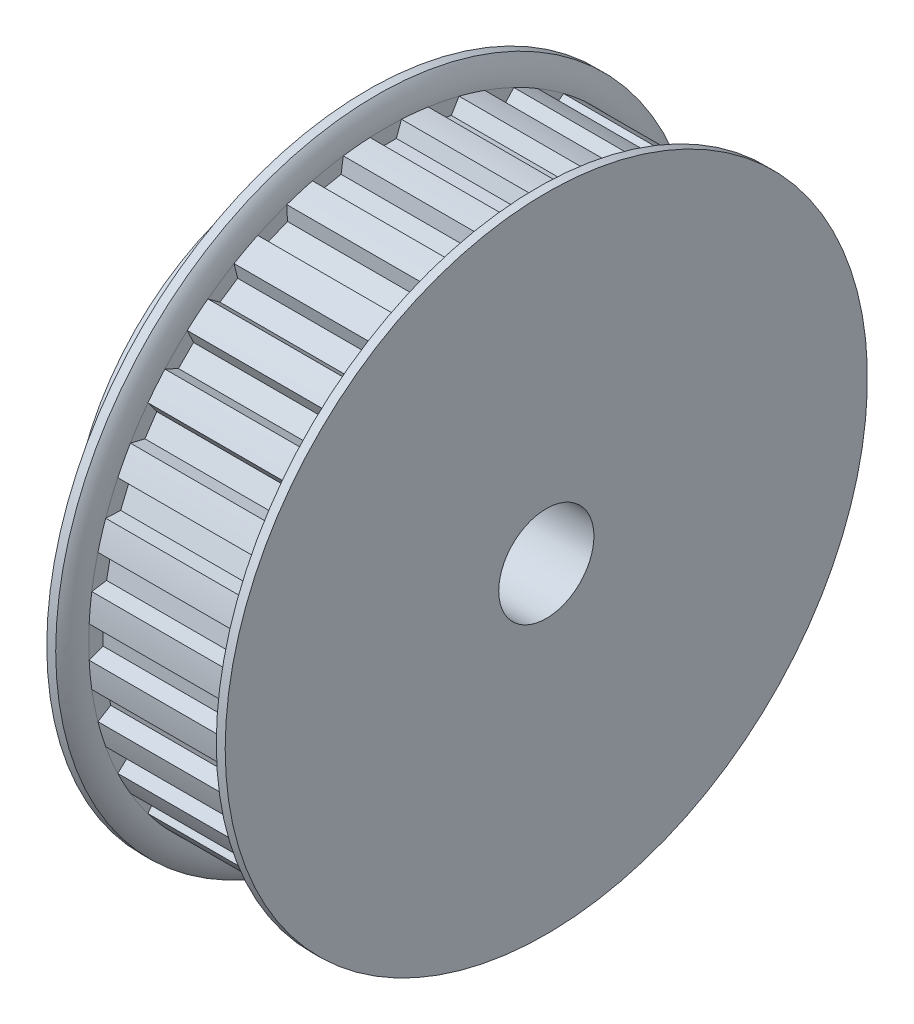
from build123d import *

# Parameters (mm, degrees)
CUT_EXTRUDE1_START = 9
CUT_EXTRUDE1_DEPTH = 12
CIRPATTERN1_COUNT  = 32


with BuildPart() as part:
    # Sketch6 → Revolve1 (revolve)
    with BuildSketch(Plane.XY, mode=Mode.PRIVATE) as revolve1_sk:
        with BuildLine():
            Line((9.75, 27), (10.5, 27))
            Line((10.5, 27), (10.5, 4))
            Line((10.5, 4), (-10.5, 4))
            Line((-10.5, 4), (-10.5, 19))
            Line((-10.5, 19), (-4.5, 19))
            Line((-4.5, 19), (-4.5, 27))
            Line((-4.5, 27), (-3.75, 27))
            ThreePointArc((-3.75, 27), (-3.193495741, 26.052058224), (-3, 24.97))
            Line((-3, 24.97), (9, 24.97))
            ThreePointArc((9, 24.97), (9.193495741, 26.052058224), (9.75, 27))
        make_face()
    revolve(revolve1_sk.sketch.rotate(Axis((-10.5, 0, 0), (1, 0, 0)), 90), axis=Axis((-10.5, 0, 0), (1, 0, 0)))

    # Sketch3 → Cut-Extrude1 (cut)
    with BuildSketch(Plane(origin=(0, 0, 0), x_dir=(0, 0, -1), z_dir=(1, 0, 0)).offset(CUT_EXTRUDE1_START)):
        with BuildLine():
            Line((-1.325, 24.934820533), (-0.894906392, 23.753148056))
            Line((-0.894906392, 23.753148056), (0.894906392, 23.753148056))
            Line((0.894906392, 23.753148056), (1.325, 24.934820533))
            ThreePointArc((1.325, 24.934820533), (0, 24.97), (-1.325, 24.934820533))
        make_face()
    cut_extrude1 = extrude(amount=-CUT_EXTRUDE1_DEPTH, mode=Mode.SUBTRACT)

    # CirPattern1: Cut-Extrude1 ×32 about axis
    cirpattern1_axis = Axis((0, 0, 0), (1, 0, 0))
    for i in range(1, CIRPATTERN1_COUNT):
        add(cut_extrude1.rotate(cirpattern1_axis, i * 360 / CIRPATTERN1_COUNT), mode=Mode.SUBTRACT)


solid = part.part
